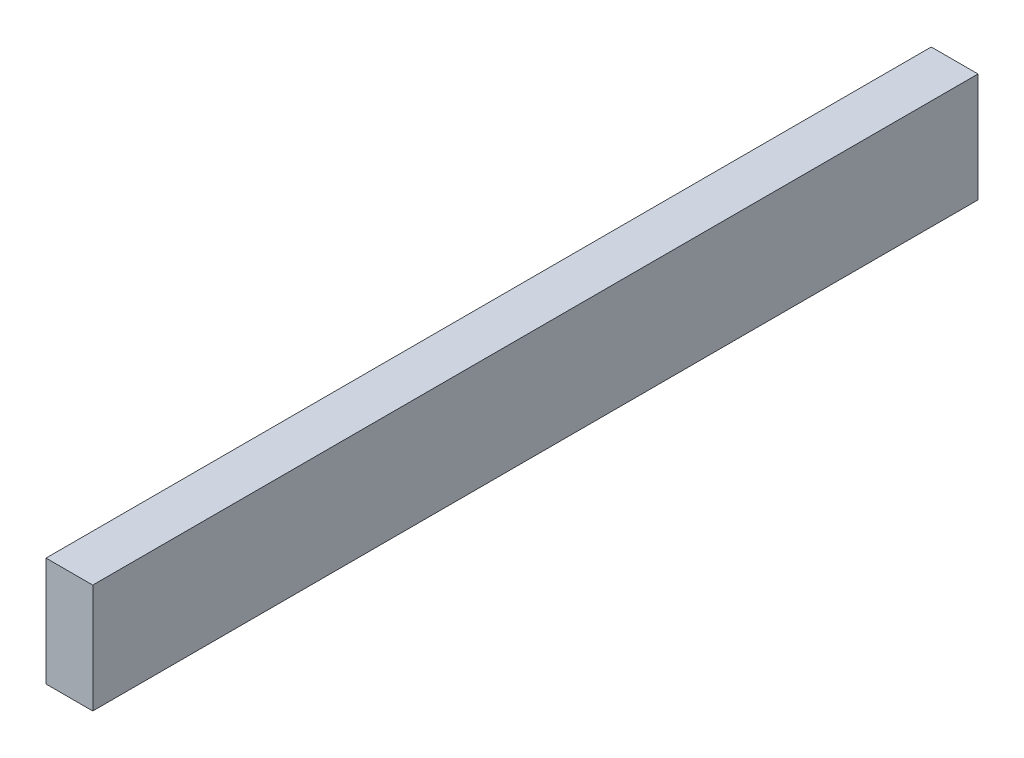
from build123d import *

# Parameters (mm, degrees)
SKETCH2_W           = 38.1
SKETCH2_H           = 88.9
BOSS_EXTRUDE1_DEPTH = 721.45


with BuildPart() as part:
    # Sketch2 → Boss-Extrude1 (new body)
    with BuildSketch(Plane.XY):
        with Locations((19.05, 44.45)):
            Rectangle(SKETCH2_W, SKETCH2_H)
    extrude(amount=BOSS_EXTRUDE1_DEPTH)


solid = part.part
